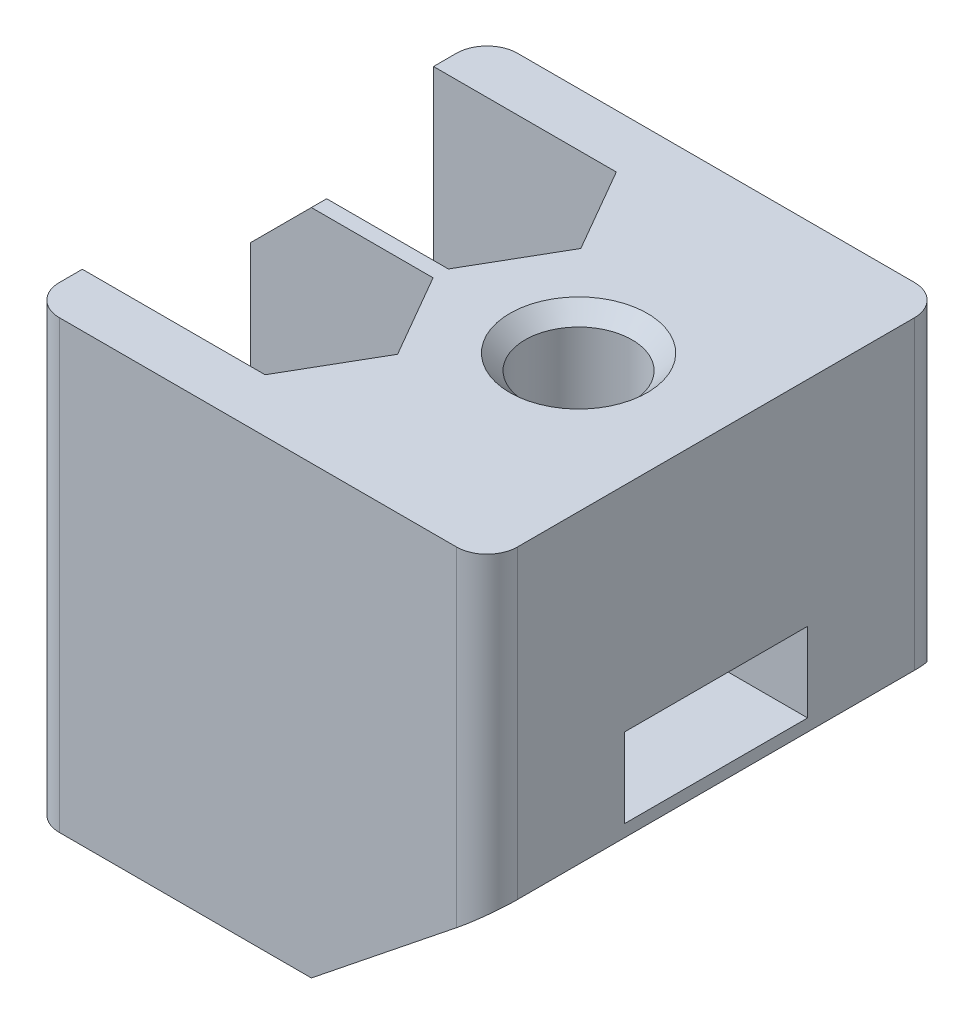
from build123d import *

# Parameters (mm, degrees)
BOSS_EXTRUDE1_DEPTH     = 1.3
SKETCH3_W               = 15
SKETCH3_H               = 15
BOSS_EXTRUDE2_DEPTH     = 5.5
SKETCH5_R               = 1.75
CUT_EXTRUDE1_DEPTH      = 14.345785852
BOSS_EXTRUDE3_START     = 1.5
SKETCH8_R               = 1.75
BOSS_EXTRUDE3_DEPTH     = 1.5
SKETCH9_R               = 1.75
BOSS_EXTRUDE4_DEPTH     = 6
CUT_EXTRUDE3_DEPTH      = 4.1
CUT_EXTRUDE4_DEPTH      = 19.712028217
CUT_EXTRUDE4_DEPTH_BACK = 19.712028217
CHAMFER1_SIZE           = 0.5
CHAMFER2_SIZE           = 2
FILLET1_R               = 1
CHAMFER3_SIZE           = 1


with BuildPart() as part:
    # Sketch2 → Boss-Extrude1 (new, symmetric)
    with BuildSketch(Plane(origin=(0, 0, 0), x_dir=(1, 0, 0), z_dir=(0, 1, 0))):
        Polygon((-7.5, 7.5), (7.5, 7.5), (7.5, 3), (4.732050808, 3), (1.267949192, 3), (-0.464101615, 0), (1.267949192, -3), (4.732050808, -3), (7.5, -3), (7.5, -7.5), (-7.5, -7.5), (-7.5, -5.75), (-7.5, 5.75), align=None)
    extrude(amount=BOSS_EXTRUDE1_DEPTH, both=True)

    # Sketch3 → Boss-Extrude2 (add)
    with BuildSketch(Plane(origin=(0, 1.3, 0), x_dir=(1, 0, 0), z_dir=(0, 1, 0))):
        Rectangle(SKETCH3_W, SKETCH3_H)
    extrude(amount=BOSS_EXTRUDE2_DEPTH)

    # Sketch5 → Cut-Extrude1 (cut, through all)
    with BuildSketch(Plane(origin=(0, 6.8, 0), x_dir=(1, 0, 0), z_dir=(0, 1, 0))):
        with Locations(Location((-3.102458521, 3, 0), (0, 0, 270))):
            Circle(SKETCH5_R)
        with Locations(Location((-3.102458521, -3, 0), (0, 0, 270))):
            Circle(SKETCH5_R)
        with Locations(Location((3, 0, 0), (0, 0, 270))):
            Circle(SKETCH5_R)
    extrude(amount=-CUT_EXTRUDE1_DEPTH, mode=Mode.SUBTRACT)

    # Sketch8 → Boss-Extrude3 (add)
    with BuildSketch(Plane(origin=(0, 6.8, 0), x_dir=(1, 0, 0), z_dir=(0, 1, 0)).offset(BOSS_EXTRUDE3_START)):
        Polygon((-7.5, 7.5), (7.5, 7.5), (7.5, 2.75), (7.5, -2.75), (7.5, -7.5), (-7.5, -7.5), (-7.5, -5.75), (-4.690171761, -5.75), (-1.514745281, -5.75), (0.07296796, -3), (-1.514745281, -0.25), (-4.690171761, -0.25), (-7.5, -0.25), (-7.5, 0.25), (-4.690171761, 0.25), (-1.514745281, 0.25), (0.07296796, 3), (-1.514745281, 5.75), (-4.690171761, 5.75), (-7.5, 5.75), align=None)
        with Locations(Location((3, 0, 0), (0, 0, 270))):
            Circle(SKETCH8_R, mode=Mode.SUBTRACT)
    extrude(amount=-BOSS_EXTRUDE3_DEPTH)

    # Sketch9 → Boss-Extrude4 (add)
    with BuildSketch(Plane.XZ.offset(1.3)):
        Polygon((7.5, 3), (7.5, -3), (7.5, -7.5), (-7.5, -7.5), (-7.5, 7.5), (7.5, 7.5), align=None)
        with Locations(Location((-3.102458521, 3, 0), (0, 0, 90))):
            Circle(SKETCH9_R, mode=Mode.SUBTRACT)
        with Locations(Location((-3.102458521, -3, 0), (0, 0, 90))):
            Circle(SKETCH9_R, mode=Mode.SUBTRACT)
    extrude(amount=BOSS_EXTRUDE4_DEPTH)

    # Sketch11 → Cut-Extrude3 (cut)
    with BuildSketch(Plane(origin=(0, 6.8, 0), x_dir=(1, 0, 0), z_dir=(0, 1, 0))):
        Polygon((-7.5, 0.25), (-1.514745281, 0.25), (0.07296796, 3), (-1.514745281, 5.75), (-7.5, 5.75), align=None)
        Polygon((-7.5, -5.75), (-1.514745281, -5.75), (0.07296796, -3), (-1.514745281, -0.25), (-7.5, -0.25), align=None)
    extrude(amount=-CUT_EXTRUDE3_DEPTH, mode=Mode.SUBTRACT)

    # Sketch10 → Cut-Extrude4 (cut, two sides: drawn at the far end of the back side and taken through both)
    with BuildSketch(Plane.XY.offset(7.5).offset(-CUT_EXTRUDE4_DEPTH_BACK)):
        Polygon((0.5, -7.3), (7.5, -1.7), (7.5, -7.3), align=None)
    extrude(amount=CUT_EXTRUDE4_DEPTH + CUT_EXTRUDE4_DEPTH_BACK, mode=Mode.SUBTRACT)

    # Chamfer1
    chamfer1_edges = [part.edges().sort_by_distance(p)[0] for p in [
        (3, 8.3, -1.75),
    ]]
    chamfer(chamfer1_edges, length=CHAMFER1_SIZE)

    # Chamfer2
    chamfer2_edges = [part.edges().sort_by_distance(p)[0] for p in [
        (-7.5, 8.3, 0),
    ]]
    chamfer(chamfer2_edges, length=CHAMFER2_SIZE)

    # Fillet1
    fillet1_edges = [part.edges().sort_by_distance(p)[0] for p in [
        (7.5, 3.3, 7.5),
        (-7.5, 0.5, 7.5),
        (-7.5, 0.5, -7.5),
        (7.5, 3.3, -7.5),
    ]]
    fillet(fillet1_edges, radius=FILLET1_R)

    # Chamfer3
    chamfer3_edges = [part.edges().sort_by_distance(p)[0] for p in [
        (-3, -7.3, 7.5),
        (-7.5, -7.3, 0),
        (-3, -7.3, -7.5),
        (-7.207106781, -7.3, -7.207106781),
        (-7.207106781, -7.3, 7.207106781),
    ]]
    chamfer(chamfer3_edges, length=CHAMFER3_SIZE)


solid = part.part
